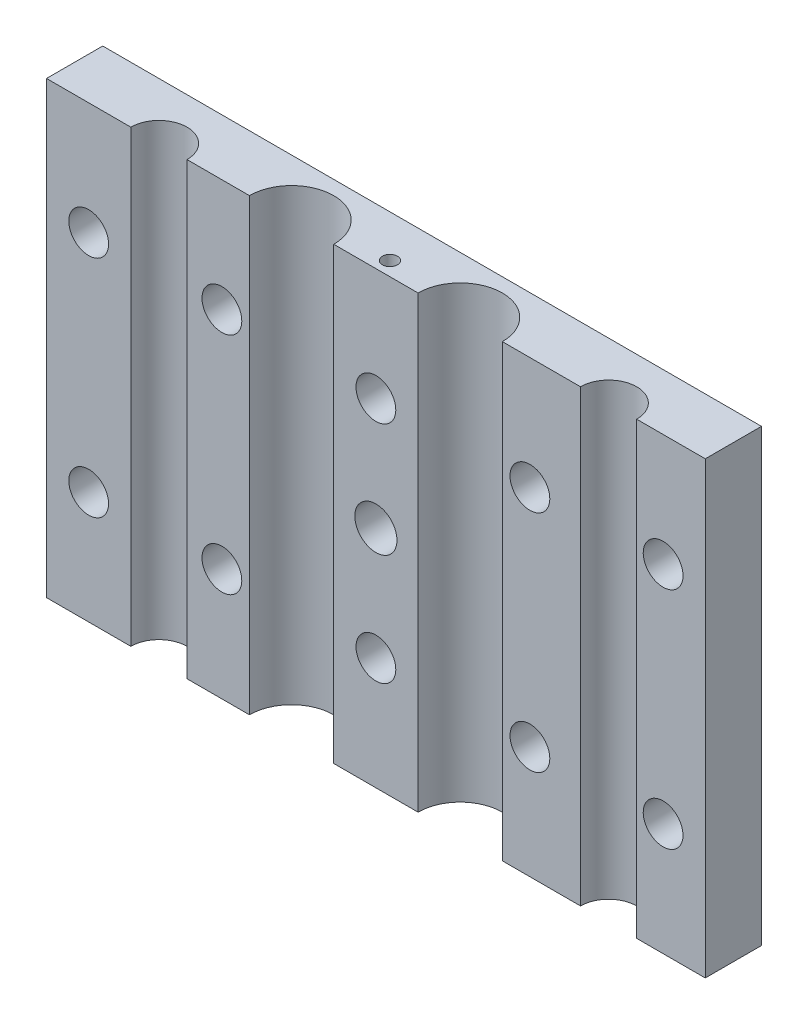
from build123d import *

# Parameters (mm, degrees)
SKETCH1_W             = 74.422
SKETCH1_H             = 50.8
BOSS_EXTRUDE1_DEPTH   = 6.35
SKETCH2_R             = 3.175
CUT_EXTRUDE1_DEPTH    = 64.289975675
SKETCH3_R             = 4.7625
CUT_EXTRUDE2_DEPTH    = 64.289975675
F_8_CLEARANCE_HOLE1_D = 4.4958
CUT_EXTRUDE3_DEPTH    = 3.175
SKETCH7_R             = 2.38125
CUT_EXTRUDE4_DEPTH    = 46.498802413
SKETCH8_R             = 0.8509
CUT_EXTRUDE5_DEPTH    = 9.525
BODY_MOVE_COPY1_ANGLE = 90


with BuildPart() as part:
    # Sketch1 → Boss-Extrude1 (new body)
    with BuildSketch(Plane(origin=(0, 0, 0), x_dir=(1, 0, 0), z_dir=(0, 1, 0))):
        Rectangle(SKETCH1_W, SKETCH1_H)
    extrude(amount=BOSS_EXTRUDE1_DEPTH)

    # Sketch2 → Cut-Extrude1 (cut, through all)
    with BuildSketch(Plane.XY.offset(25.4)):
        with Locations((-24.511, 0)):
            Circle(SKETCH2_R)
        with Locations((26.289, 0)):
            Circle(SKETCH2_R)
    extrude(amount=-CUT_EXTRUDE1_DEPTH, mode=Mode.SUBTRACT)

    # Sketch3 → Cut-Extrude2 (cut, through all)
    with BuildSketch(Plane.XY.offset(25.4)):
        with Locations((-9.525, 0)):
            Circle(SKETCH3_R)
        with Locations((9.525, 0)):
            Circle(SKETCH3_R)
    extrude(amount=-CUT_EXTRUDE2_DEPTH, mode=Mode.SUBTRACT)

    # #8 Clearance Hole1 (through all)
    with Locations(Plane(origin=(0, 6.35, 0), x_dir=(1, 0, 0), z_dir=(0, 1, 0))):
        with Locations((-32.4485, 12.7), (-32.4485, -12.7), (-17.399, -12.7), (0, -12.7), (17.399, -12.7), (32.4485, -12.7), (32.4485, 12.7), (17.399, 12.7), (0, 12.7), (-17.399, 12.7)):
            Hole(F_8_CLEARANCE_HOLE1_D / 2)

    # Sketch6 → Cut-Extrude3 (cut)
    with BuildSketch(Plane(origin=(0, 6.35, 0), x_dir=(1, 0, 0), z_dir=(0, 1, 0))):
        with BuildLine():
            Line((-13.081, 17.018), (-13.081, 8.382))
            ThreePointArc((-13.081, 8.382), (-17.399, 4.064), (-21.717, 8.382))
            Line((-21.717, 8.382), (-21.717, 17.018))
            ThreePointArc((-21.717, 17.018), (-17.399, 21.336), (-13.081, 17.018))
        make_face()
        with BuildLine():
            Line((13.081, 17.018), (13.081, 8.382))
            ThreePointArc((13.081, 8.382), (17.399, 4.064), (21.717, 8.382))
            Line((21.717, 8.382), (21.717, 17.018))
            ThreePointArc((21.717, 17.018), (17.399, 21.336), (13.081, 17.018))
        make_face()
        with BuildLine():
            Line((13.081, -17.018), (13.081, -8.382))
            ThreePointArc((13.081, -8.382), (17.399, -4.064), (21.717, -8.382))
            Line((21.717, -8.382), (21.717, -17.018))
            ThreePointArc((21.717, -17.018), (17.399, -21.336), (13.081, -17.018))
        make_face()
        with BuildLine():
            Line((-13.081, -17.018), (-13.081, -8.382))
            ThreePointArc((-13.081, -8.382), (-17.399, -4.064), (-21.717, -8.382))
            Line((-21.717, -8.382), (-21.717, -17.018))
            ThreePointArc((-21.717, -17.018), (-17.399, -21.336), (-13.081, -17.018))
        make_face()
        with BuildLine():
            Line((4.318, 17.018), (4.318, 8.382))
            ThreePointArc((4.318, 8.382), (0, 4.064), (-4.318, 8.382))
            Line((-4.318, 8.382), (-4.318, 17.018))
            ThreePointArc((-4.318, 17.018), (0, 21.336), (4.318, 17.018))
        make_face()
        with BuildLine():
            Line((4.318, -17.018), (4.318, -8.382))
            ThreePointArc((4.318, -8.382), (0, -4.064), (-4.318, -8.382))
            Line((-4.318, -8.382), (-4.318, -17.018))
            ThreePointArc((-4.318, -17.018), (0, -21.336), (4.318, -17.018))
        make_face()
        with BuildLine():
            Line((-28.1305, 17.018), (-28.1305, 8.382))
            ThreePointArc((-28.1305, 8.382), (-32.4485, 4.064), (-36.7665, 8.382))
            Line((-36.7665, 8.382), (-36.7665, 17.018))
            ThreePointArc((-36.7665, 17.018), (-32.4485, 21.336), (-28.1305, 17.018))
        make_face()
        with BuildLine():
            Line((-28.1305, -17.018), (-28.1305, -8.382))
            ThreePointArc((-28.1305, -8.382), (-32.4485, -4.064), (-36.7665, -8.382))
            Line((-36.7665, -8.382), (-36.7665, -17.018))
            ThreePointArc((-36.7665, -17.018), (-32.4485, -21.336), (-28.1305, -17.018))
        make_face()
        with BuildLine():
            Line((28.1305, 17.018), (28.1305, 8.382))
            ThreePointArc((28.1305, 8.382), (32.4485, 4.064), (36.7665, 8.382))
            Line((36.7665, 8.382), (36.7665, 17.018))
            ThreePointArc((36.7665, 17.018), (32.4485, 21.336), (28.1305, 17.018))
        make_face()
        with BuildLine():
            Line((28.1305, -17.018), (28.1305, -8.382))
            ThreePointArc((28.1305, -8.382), (32.4485, -4.064), (36.7665, -8.382))
            Line((36.7665, -8.382), (36.7665, -17.018))
            ThreePointArc((36.7665, -17.018), (32.4485, -21.336), (28.1305, -17.018))
        make_face()
    extrude(amount=-CUT_EXTRUDE3_DEPTH, mode=Mode.SUBTRACT)

    # Sketch7 → Cut-Extrude4 (cut, through all)
    with BuildSketch(Plane(origin=(0, 6.35, 0), x_dir=(1, 0, 0), z_dir=(0, 1, 0))):
        with Locations(Location((0, 0, 0), (0, 0, 270))):
            Circle(SKETCH7_R)
    extrude(amount=-CUT_EXTRUDE4_DEPTH, mode=Mode.SUBTRACT)

    # Sketch8 → Cut-Extrude5 (cut)
    with BuildSketch(Plane.XY.offset(25.4)):
        with Locations((0, 1.5875)):
            Circle(SKETCH8_R)
    extrude(amount=-CUT_EXTRUDE5_DEPTH, mode=Mode.SUBTRACT)


with BuildPart() as part_1:
    # Body-Move/Copy1: moved
    add(part.part.rotate(Axis((0, 3.175, 0), (-1, 0, 0)), BODY_MOVE_COPY1_ANGLE))


solid = part_1.part
